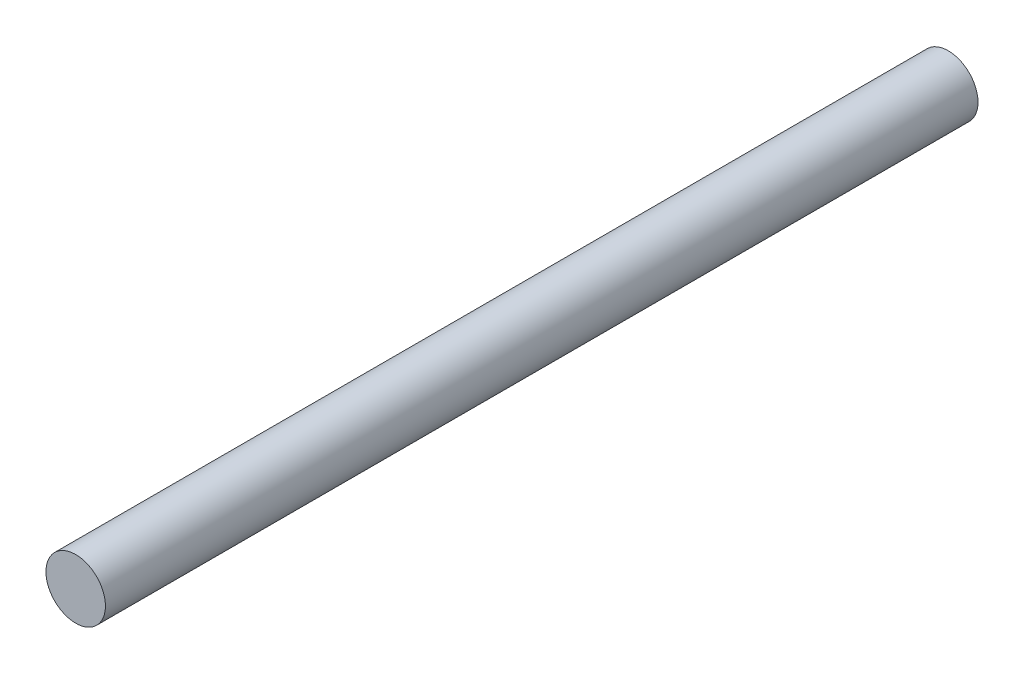
from build123d import *

# Parameters (mm, degrees)
CROQUIS1_R              = 1.5
SALIENTE_EXTRUIR1_DEPTH = 44


with BuildPart() as part:
    # Croquis1 → Saliente-Extruir1 (new body)
    with BuildSketch(Plane.XY):
        Circle(CROQUIS1_R)
    extrude(amount=SALIENTE_EXTRUIR1_DEPTH)


solid = part.part
